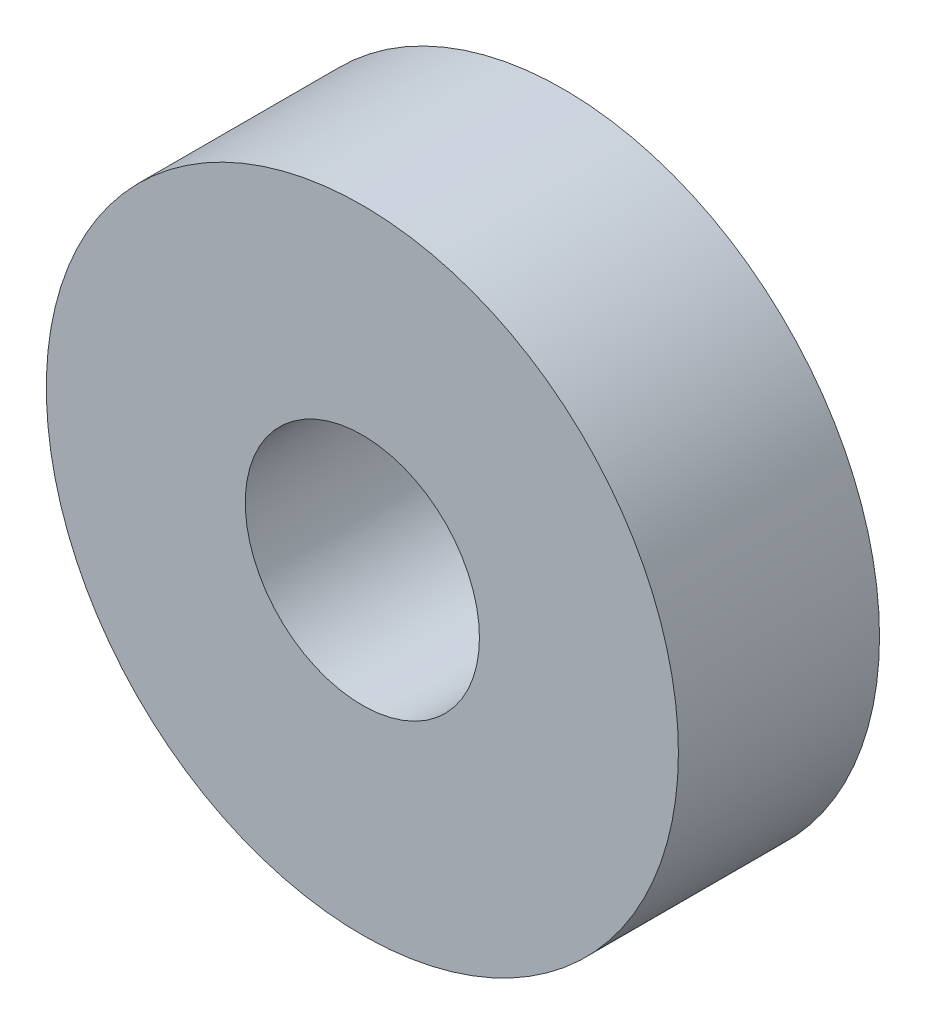
from build123d import *

# Parameters (mm, degrees)
ESQUISSE1_R        = 11
ESQUISSE1_R_2      = 4.075
BOSS_EXTRU_1_DEPTH = 7


with BuildPart() as part:
    # Esquisse1 → Boss.-Extru.1 (new body)
    with BuildSketch(Plane.XY):
        Circle(ESQUISSE1_R)
        Circle(ESQUISSE1_R_2, mode=Mode.SUBTRACT)
    extrude(amount=BOSS_EXTRU_1_DEPTH)


solid = part.part
